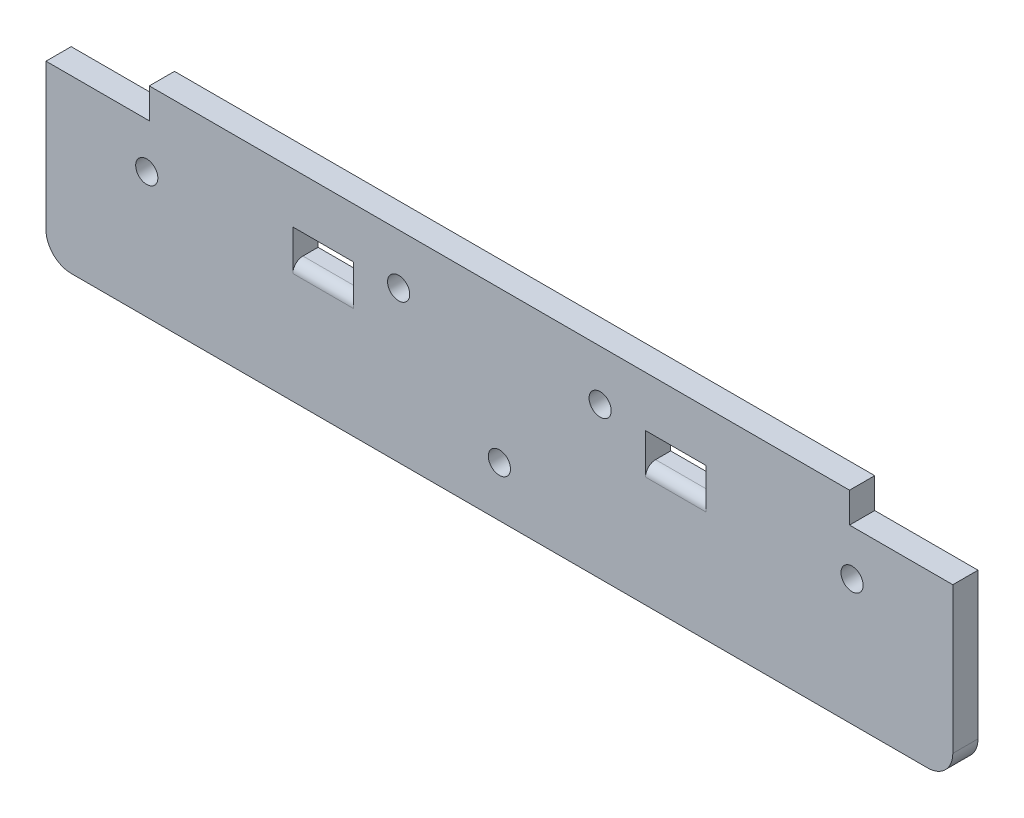
from build123d import *

# Parameters (mm, degrees)
SZKIC1_W                    = 180
SZKIC1_H                    = 40
DODANIE_WYCI_GNI_CIE1_DEPTH = 5
ZAOKR_GLENIE1_R             = 5
SZKIC2_R                    = 2.2
WYTNIJ_WYCI_GNI_CIE1_DEPTH  = 5
SZKIC3_W                    = 20.5
SZKIC3_H                    = 6
WYTNIJ_WYCI_GNI_CIE2_DEPTH  = 10
SZKIC4_R                    = 2.2
WYTNIJ_WYCI_GNI_CIE3_DEPTH  = 10
SZKIC5_W                    = 12
SZKIC5_H                    = 6
WYTNIJ_WYCI_GNI_CIE4_DEPTH  = 93.330926563
ZAOKR_GLENIE2_R             = 2


with BuildPart() as part:
    # Szkic1 → Dodanie-wyciągnięcie1 (new body)
    with BuildSketch(Plane.XY):
        Rectangle(SZKIC1_W, SZKIC1_H)
    extrude(amount=DODANIE_WYCI_GNI_CIE1_DEPTH)

    # Zaokrąglenie1
    zaokr_glenie1_edges = [part.edges().sort_by_distance(p)[0] for p in [
        (90, -20, 2.5),
        (-90, -20, 2.5),
        (-90, 20, 2.5),
        (90, 20, 2.5),
    ]]
    fillet(zaokr_glenie1_edges, radius=ZAOKR_GLENIE1_R)

    # Szkic2 → Wytnij-wyciągnięcie1 (cut)
    with BuildSketch(Plane.XY.offset(5)):
        with Locations((-70, 5)):
            Circle(SZKIC2_R)
        with Locations((-20, 10)):
            Circle(SZKIC2_R)
        with Locations((20, 10)):
            Circle(SZKIC2_R)
        with Locations((70, 5)):
            Circle(SZKIC2_R)
    extrude(amount=-WYTNIJ_WYCI_GNI_CIE1_DEPTH, mode=Mode.SUBTRACT)

    # Szkic3 → Wytnij-wyciągnięcie2 (cut)
    with BuildSketch(Plane.XY.offset(5)):
        with Locations((-79.75, 17)):
            Rectangle(SZKIC3_W, SZKIC3_H)
        with Locations((79.75, 17)):
            Rectangle(SZKIC3_W, SZKIC3_H)
    extrude(amount=-WYTNIJ_WYCI_GNI_CIE2_DEPTH, mode=Mode.SUBTRACT)

    # Szkic4 → Wytnij-wyciągnięcie3 (cut)
    with BuildSketch(Plane.XY.offset(5)):
        with Locations((0, -10)):
            Circle(SZKIC4_R)
    extrude(amount=-WYTNIJ_WYCI_GNI_CIE3_DEPTH, mode=Mode.SUBTRACT)

    # Szkic5 → Wytnij-wyciągnięcie4 (cut, through all)
    with BuildSketch(Plane.XY.offset(5)):
        with Locations((-35, 7)):
            Rectangle(SZKIC5_W, SZKIC5_H)
        with Locations((35, 7)):
            Rectangle(SZKIC5_W, SZKIC5_H)
    extrude(amount=-WYTNIJ_WYCI_GNI_CIE4_DEPTH, mode=Mode.SUBTRACT)

    # Zaokrąglenie2
    zaokr_glenie2_edges = [part.edges().sort_by_distance(p)[0] for p in [
        (-35, 4, 5),
        (35, 4, 5),
    ]]
    fillet(zaokr_glenie2_edges, radius=ZAOKR_GLENIE2_R)


solid = part.part
